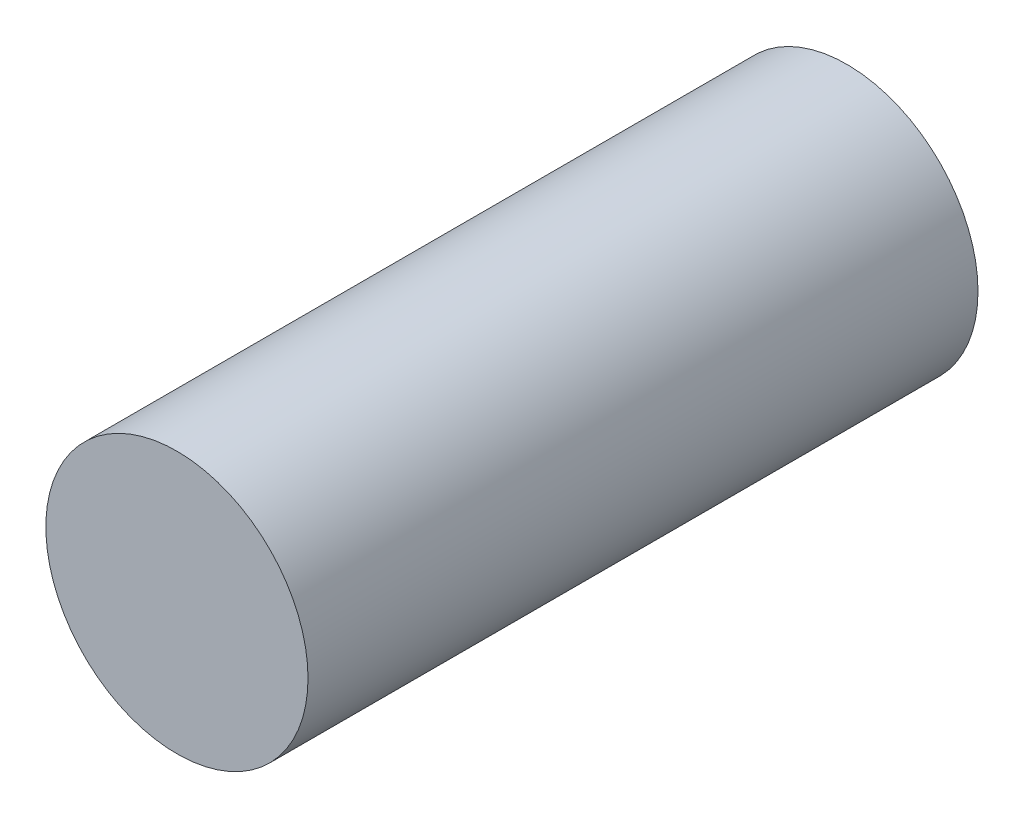
from build123d import *

# Parameters (mm, degrees)
SKETCH_1_R      = 4.5
EXTRUDE_1_DEPTH = 23


with BuildPart() as part:
    # 草图1 → 凸台-拉伸1 (new body)
    with BuildSketch(Plane.XY):
        Circle(SKETCH_1_R)
    extrude(amount=EXTRUDE_1_DEPTH)


solid = part.part
